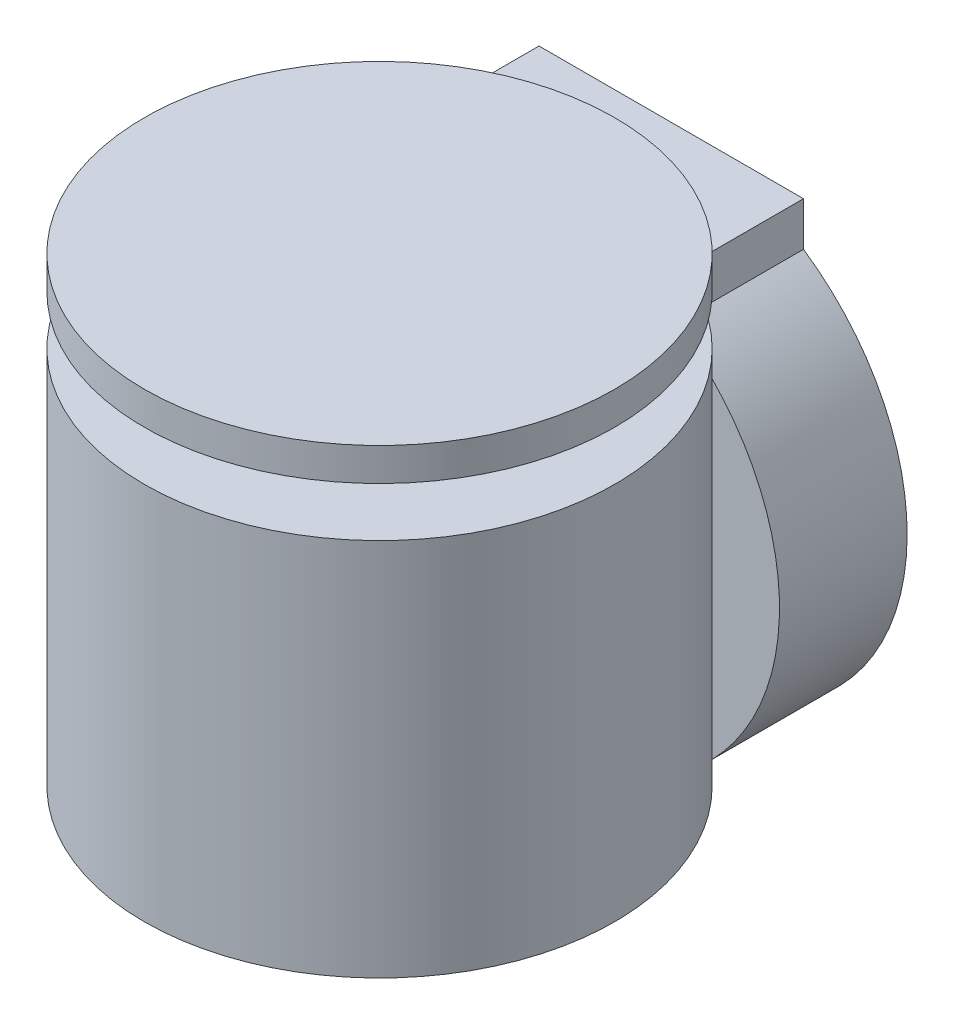
from build123d import *

# Parameters (mm, degrees)
BOSS_EXTRUDE1_DEPTH      = 0.023
BOSS_EXTRUDE1_DEPTH_BACK = 0.023
SKETCH1_R                = 0.028561519
BOSS_EXTRUDE2_START      = 0.029
SKETCH1_2_R              = 0.028561519
BOSS_EXTRUDE2_DEPTH      = 0.004
BOSS_EXTRUDE3_START      = -0.02
BOSS_EXTRUDE3_DEPTH      = 0.0155


with BuildPart() as part:
    # Sketch1 → Boss-Extrude1 (new, two sides: drawn at the far end of the back side and taken through both)
    with BuildSketch(Plane(origin=(0, 0, 0), x_dir=(1, 0, 0), z_dir=(0, 1, 0)).offset(-BOSS_EXTRUDE1_DEPTH_BACK)):
        Circle(SKETCH1_R)
    extrude(amount=BOSS_EXTRUDE1_DEPTH + BOSS_EXTRUDE1_DEPTH_BACK)



with BuildPart() as body_2:
    # Sketch1<2> → Boss-Extrude2 (new body)
    with BuildSketch(Plane(origin=(0, 0, 0), x_dir=(1, 0, 0), z_dir=(0, 1, 0)).offset(BOSS_EXTRUDE2_START)):
        Circle(SKETCH1_2_R)
    extrude(amount=BOSS_EXTRUDE2_DEPTH)


with BuildPart() as part_1:
    add(part.part)

    add(body_2.part)  # Boss-Extrude3 merges body 2
    # Sketch2 → Boss-Extrude3 (add)
    with BuildSketch(Plane.XY.offset(BOSS_EXTRUDE3_START)):
        with BuildLine():
            Line((-0.016131092, 0.023575884), (-0.016131092, 0.029))
            Line((-0.016131092, 0.029), (0.015982454, 0.029))
            Line((0.015982454, 0.029), (0.015982454, 0.0236769))
            ThreePointArc((0.015982454, 0.0236769), (8.9858e-05, -0.028566175), (-0.016131092, 0.023575884))
        make_face()
    extrude(amount=-BOSS_EXTRUDE3_DEPTH)


solid = part_1.part
